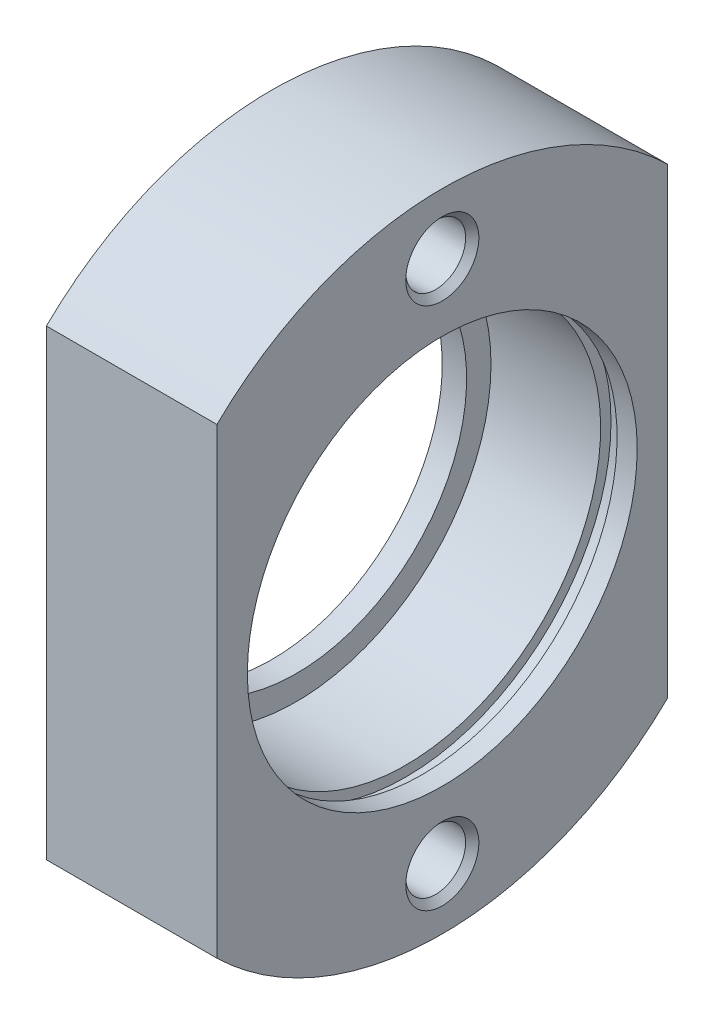
from build123d import *

# Parameters (mm, degrees)
BOSS_EXTRUDE1_DEPTH      = 7
BOSS_EXTRUDE1_DEPTH_BACK = 7
SKETCH3_W                = 1.35
SKETCH3_H                = 16.85


with BuildPart() as part:
    # Sketch1 → Boss-Extrude1 (new, two sides: drawn at the far end of the back side and taken through both)
    with BuildSketch(Plane(origin=(0, 0, 0), x_dir=(0, 0, -1), z_dir=(1, 0, 0)).offset(-BOSS_EXTRUDE1_DEPTH_BACK)):
        with BuildLine():
            Line((-18.5, 18.973665961), (-18.5, -18.973665961))
            ThreePointArc((-18.5, -18.973665961), (0, -26.5), (18.5, -18.973665961))
            Line((18.5, -18.973665961), (18.5, 18.973665961))
            ThreePointArc((18.5, 18.973665961), (0, 26.5), (-18.5, 18.973665961))
        make_face()
    extrude(amount=BOSS_EXTRUDE1_DEPTH + BOSS_EXTRUDE1_DEPTH_BACK)

    # Sketch2 → Cut-Revolve1 (revolve, cut)
    with BuildSketch(Plane.XY):
        Polygon((-7, 0), (-7, 14), (-5, 14), (-5, 16), (7, 16), (7, 0), align=None)
    revolve(axis=Axis((7, 0, 0), (-1, 0, 0)), mode=Mode.SUBTRACT)

    # Sketch3 → Cut-Revolve2 (revolve, cut)
    with BuildSketch(Plane.XY):
        with Locations((4.675, 8.425)):
            Rectangle(SKETCH3_W, SKETCH3_H)
    revolve(axis=Axis((5.35, 0, 0), (-1, 0, 0)), mode=Mode.SUBTRACT)

    # Sketch4 → Cut-Revolve3 (revolve, cut)
    with BuildSketch(Plane.XY):
        Polygon((-7, -21.5), (-7, -18.5), (-6.4585, -19.0415), (6.4585, -19.0415), (7, -18.5), (7, -21.5), align=None)
    revolve(axis=Axis((7, -21.5, 0), (-1, 0, 0)), mode=Mode.SUBTRACT)

    # Sketch5 → Cut-Revolve4 (revolve, cut)
    with BuildSketch(Plane.XY):
        Polygon((-7, 21.5), (-7, 24.5), (-6.4585, 23.9585), (6.4585, 23.9585), (7, 24.5), (7, 21.5), align=None)
    revolve(axis=Axis((7, 21.5, 0), (-1, 0, 0)), mode=Mode.SUBTRACT)


solid = part.part
